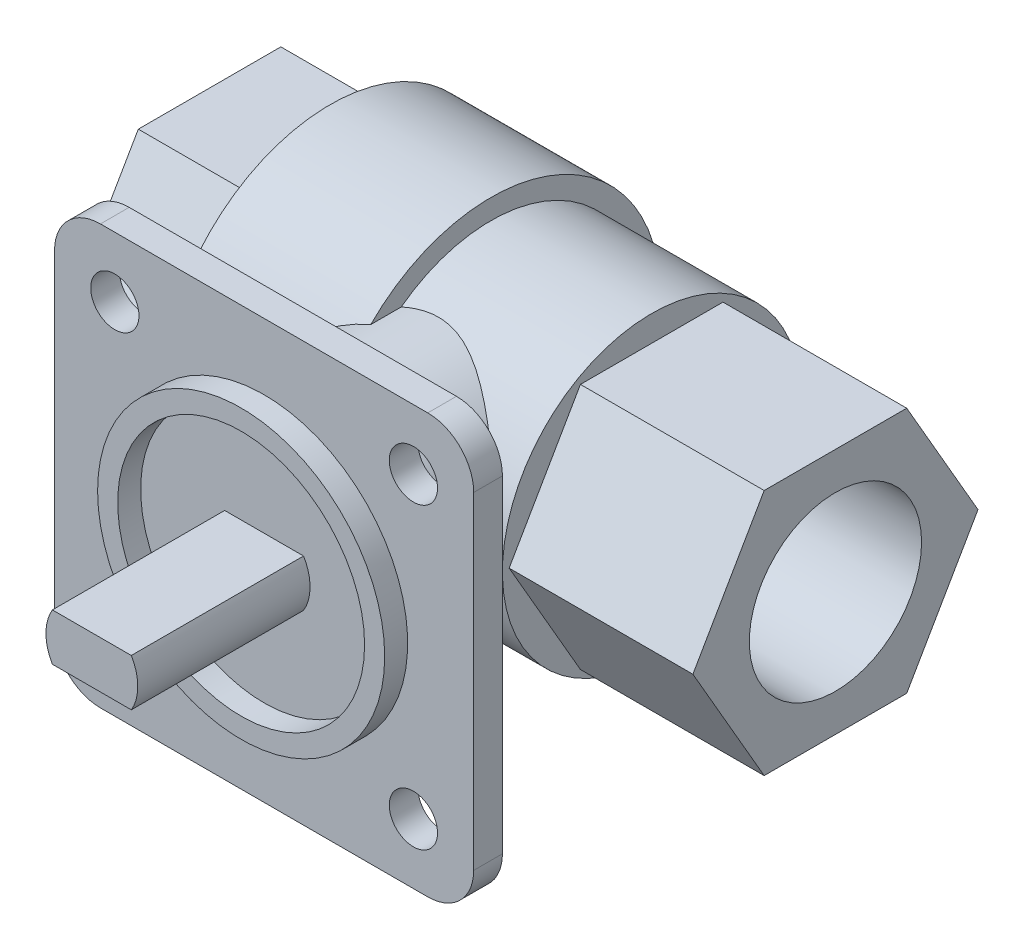
from build123d import *

# Parameters (mm, degrees)
BOSS_EXTRUDE1_DEPTH = 10.5
SKETCH2_R           = 14.75
BOSS_EXTRUDE2_DEPTH = 14
SKETCH3_R           = 13
BOSS_EXTRUDE3_DEPTH = 14
BOSS_EXTRUDE4_DEPTH = 16
SKETCH5_R           = 10.75
BOSS_EXTRUDE5_DEPTH = 20
SKETCH6_R           = 2.1
BOSS_EXTRUDE6_DEPTH = 2.5
CUT_EXTRUDE1_REACH  = 63.722
SKETCH7_R           = 7.5
SKETCH8_R           = 12.5
SKETCH8_R_2         = 10.75
BOSS_EXTRUDE7_DEPTH = 2
BOSS_EXTRUDE8_DEPTH = 15


with BuildPart() as part:
    # Sketch1 → Boss-Extrude1 (new body)
    with BuildSketch(Plane.YZ):
        Polygon((0, 12.413030788), (-10.75, 6.206515394), (-10.75, -6.206515394), (0, -12.413030788), (10.75, -6.206515394), (10.75, 6.206515394), align=None)
    extrude(amount=BOSS_EXTRUDE1_DEPTH)

    # Sketch2 → Boss-Extrude2 (add)
    with BuildSketch(Plane.YZ.offset(10.5)):
        with Locations(Location((0, 0, 0), (0, 0, 270))):
            Circle(SKETCH2_R)
    extrude(amount=BOSS_EXTRUDE2_DEPTH)

    # Sketch3 → Boss-Extrude3 (add)
    with BuildSketch(Plane.YZ.offset(24.5)):
        with Locations(Location((0, 0, 0), (0, 0, 270))):
            Circle(SKETCH3_R)
    extrude(amount=BOSS_EXTRUDE3_DEPTH)

    # Sketch4 → Boss-Extrude4 (add)
    with BuildSketch(Plane.YZ.offset(38.5)):
        Polygon((0, 12.413030788), (-10.75, 6.206515394), (-10.75, -6.206515394), (0, -12.413030788), (10.75, -6.206515394), (10.75, 6.206515394), align=None)
    extrude(amount=BOSS_EXTRUDE4_DEPTH)

    # Sketch5 → Boss-Extrude5 (add)
    with BuildSketch(Plane(origin=(0, 0, 0), x_dir=(0, 1, 0), z_dir=(0, 0, 1))):
        with Locations(Location((0, -27.25, 0), (0, 0, 14.821821062))):
            Circle(SKETCH5_R)
    extrude(amount=BOSS_EXTRUDE5_DEPTH)

    # Sketch6 → Boss-Extrude6 (add)
    with BuildSketch(Plane.XY.offset(20)):
        with BuildLine():
            Line((13, -18.25), (41.5, -18.25))
            ThreePointArc((41.5, -18.25), (44.328427125, -17.078427125), (45.5, -14.25))
            Line((45.5, -14.25), (45.5, 14.25))
            ThreePointArc((45.5, 14.25), (44.328427125, 17.078427125), (41.5, 18.25))
            Line((41.5, 18.25), (13, 18.25))
            ThreePointArc((13, 18.25), (10.171572875, 17.078427125), (9, 14.25))
            Line((9, 14.25), (9, -14.25))
            ThreePointArc((9, -14.25), (10.171572875, -17.078427125), (13, -18.25))
        make_face()
        with Locations((14.25, 13)):
            Circle(SKETCH6_R, mode=Mode.SUBTRACT)
        with Locations((40.25, 13)):
            Circle(SKETCH6_R, mode=Mode.SUBTRACT)
        with Locations((40.25, -13)):
            Circle(SKETCH6_R, mode=Mode.SUBTRACT)
        with Locations((14.25, -13)):
            Circle(SKETCH6_R, mode=Mode.SUBTRACT)
    extrude(amount=BOSS_EXTRUDE6_DEPTH)

    # Sketch7 → Cut-Extrude1 (cut, up to next)
    with BuildSketch(Plane.YZ.offset(54.5), mode=Mode.PRIVATE) as cut_extrude1_sk1:
        with Locations(Location((0, 0, 0), (0, 0, 270))):
            Circle(SKETCH7_R)
    cut_extrude1_tool1 = extrude(cut_extrude1_sk1.sketch, amount=-CUT_EXTRUDE1_REACH, mode=Mode.PRIVATE) & part.part
    add(cut_extrude1_tool1.solids().sort_by_distance((54.5, 0, 0))[0], mode=Mode.SUBTRACT)

    # Sketch8 → Boss-Extrude7 (add)
    with BuildSketch(Plane.XY.offset(22.5)):
        with Locations(Location((27.25, 0, 0), (0, 0, 180))):
            Circle(SKETCH8_R)
        with Locations(Location((27.25, 0, 0), (0, 0, 104.821821062))):
            Circle(SKETCH8_R_2, mode=Mode.SUBTRACT)
    extrude(amount=BOSS_EXTRUDE7_DEPTH)

    # Sketch9 → Boss-Extrude8 (add)
    with BuildSketch(Plane.XY.offset(22.5)):
        with BuildLine():
            Line((23.815251101, -2.05), (30.684748899, -2.05))
            ThreePointArc((30.684748899, -2.05), (31.25, 0), (30.684748899, 2.05))
            Line((30.684748899, 2.05), (23.815251101, 2.05))
            ThreePointArc((23.815251101, 2.05), (23.25, 0), (23.815251101, -2.05))
        make_face()
    extrude(amount=BOSS_EXTRUDE8_DEPTH)


solid = part.part
